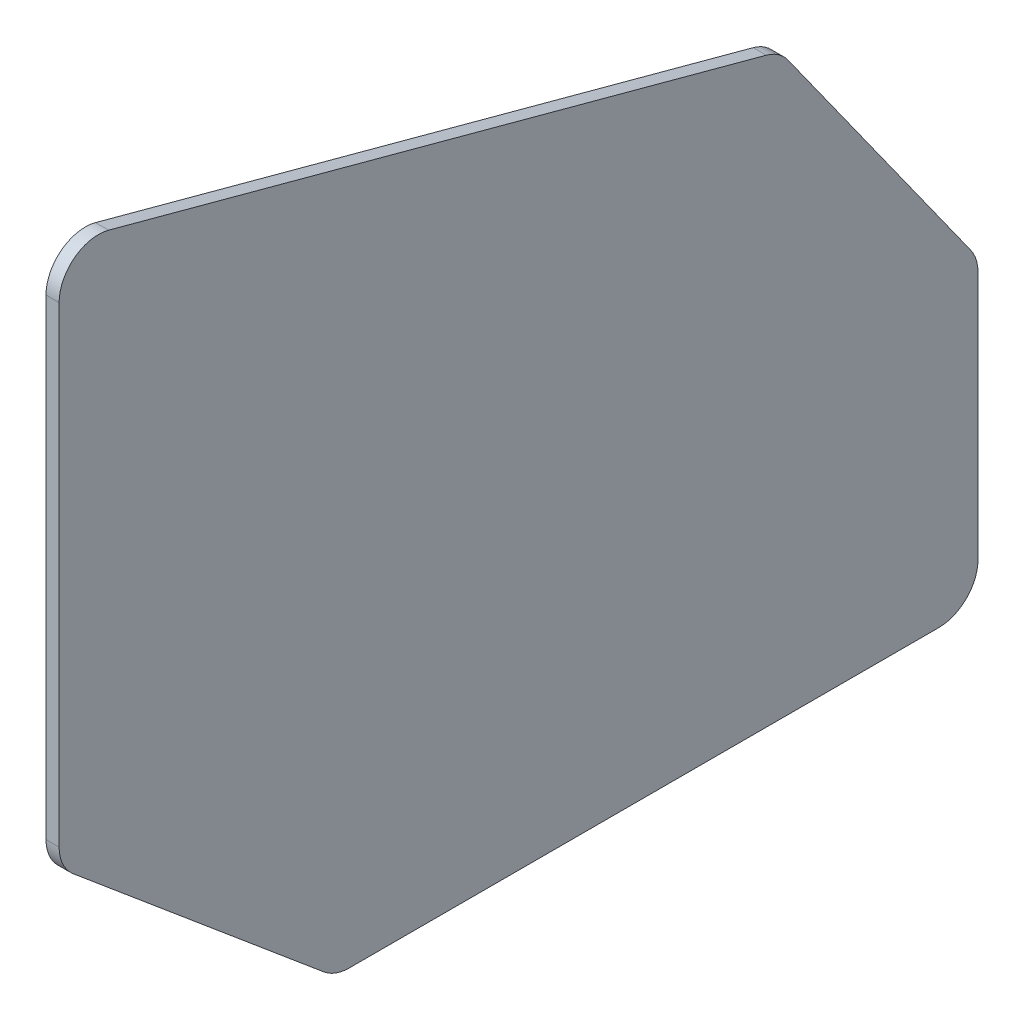
from build123d import *

# Parameters (mm, degrees)
BOSS_EXTRUDE1_DEPTH = 10
CUT_EXTRUDE3_DEPTH  = 7


with BuildPart() as part:
    # Sketch1 → Boss-Extrude1 (new body)
    with BuildSketch(Plane(origin=(0, 0, 0), x_dir=(0, 0, -1), z_dir=(1, 0, 0))):
        with BuildLine():
            Line((0, -39.159060238), (0, -399.159060238))
            ThreePointArc((0, -399.159060238), (2.810766389, -411.83760809), (10.716371709, -422.140393531))
            Line((10.716371709, -422.140393531), (202.227482489, -582.837295953))
            ThreePointArc((202.227482489, -582.837295953), (211.25050648, -588.046741283), (221.51111078, -589.855962659))
            Line((221.51111078, -589.855962659), (671.51111078, -589.855962659))
            ThreePointArc((671.51111078, -589.855962659), (692.724314215, -581.069166095), (701.51111078, -559.855962659))
            Line((701.51111078, -559.855962659), (701.51111078, -369.855962659))
            ThreePointArc((701.51111078, -369.855962659), (700.081380744, -360.705024227), (695.928465834, -352.426310564))
            Line((695.928465834, -352.426310564), (556.491249073, -157.087470131))
            ThreePointArc((556.491249073, -157.087470131), (549.188422732, -149.877866821), (539.883012979, -145.551320648))
            Line((539.883012979, -145.551320648), (37.809118961, -10.19325866))
            ThreePointArc((37.809118961, -10.19325866), (11.755460664, -15.344426409), (0, -39.159060238))
        make_face()
    extrude(amount=BOSS_EXTRUDE1_DEPTH)

    # Sketch5 → Cut-Extrude3 (cut)
    with BuildSketch(Plane.ZY):
        with BuildLine():
            ThreePointArc((-331.179728441, -194.685467652), (-341.545058852, -204.318697463), (-332.693478174, -215.359019498))
            add(Edge.make_bspline(
                [(-332.693478174, -215.359019498), (-331.921739283, -215.472572374), (-226.918714052, -224.562098265), (-126.325036043, -154.802617957), (-92.163413905, -98.198220596)],
                knots=[0, 0, 0, 0, 0.354260741, 1, 1, 1, 1], degree=3))
            ThreePointArc((-92.163413905, -98.198220596), (-93.433821546, -92.827514339), (-98.829146805, -93.988930122))
            add(Edge.make_bspline(
                [(-98.829146805, -93.988930122), (-112.622758483, -114.88285895), (-192.730208888, -182.13783781), (-300.184384568, -194.688304583), (-331.179728441, -194.685467652)],
                knots=[0, 0, 0, 0, 0.660882752, 1, 1, 1, 1], degree=3))
        make_face()
        with BuildLine():
            ThreePointArc((-626.364411935, -475.947865394), (-654.270375926, -492.315038086), (-646.133694128, -523.626722446))
            add(Edge.make_bspline(
                [(-646.133694128, -523.626722446), (-620.265200397, -544.090123727), (-324.808789115, -589.015611509), (-14.475713482, -342.918185901), (-34.207392898, -327.560917886)],
                knots=[0, 0, 0, 0, 0.454280693, 1, 1, 1, 1], degree=3))
            ThreePointArc((-34.207392898, -327.560917886), (-38.301805286, -326.1553415), (-42.396217675, -327.560917886))
            add(Edge.make_bspline(
                [(-42.396217675, -327.560917886), (-179.998241324, -434.657283692), (-369.496171973, -510.067463814), (-572.427382245, -482.279425386), (-626.364411935, -475.947865394)],
                knots=[0, 0, 0, 0, 0.742688993, 1, 1, 1, 1], degree=3))
        make_face()
        with BuildLine():
            ThreePointArc((-567.085033992, -348.175125638), (-594.800287265, -365.58541059), (-577.755509271, -393.526935767))
            add(Edge.make_bspline(
                [(-577.755509271, -393.526935767), (-509.639726303, -410.500517765), (-300.322217315, -390.035120939), (-100.320017518, -254.957400328), (-66.698936736, -215.359019498)],
                knots=[0, 0, 0, 0, 0.345289595, 1, 1, 1, 1], degree=3))
            ThreePointArc((-66.698936736, -215.359019498), (-67.092959072, -208.260098077), (-74.202765192, -208.284508838))
            add(Edge.make_bspline(
                [(-74.202765192, -208.284508838), (-81.149231878, -214.924232147), (-316.076431581, -369.790908175), (-526.742508558, -357.109499901), (-567.085033992, -348.175125638)],
                knots=[0, 0, 0, 0, 0.768435057, 1, 1, 1, 1], degree=3))
        make_face()
    extrude(amount=-CUT_EXTRUDE3_DEPTH, mode=Mode.SUBTRACT)


solid = part.part
